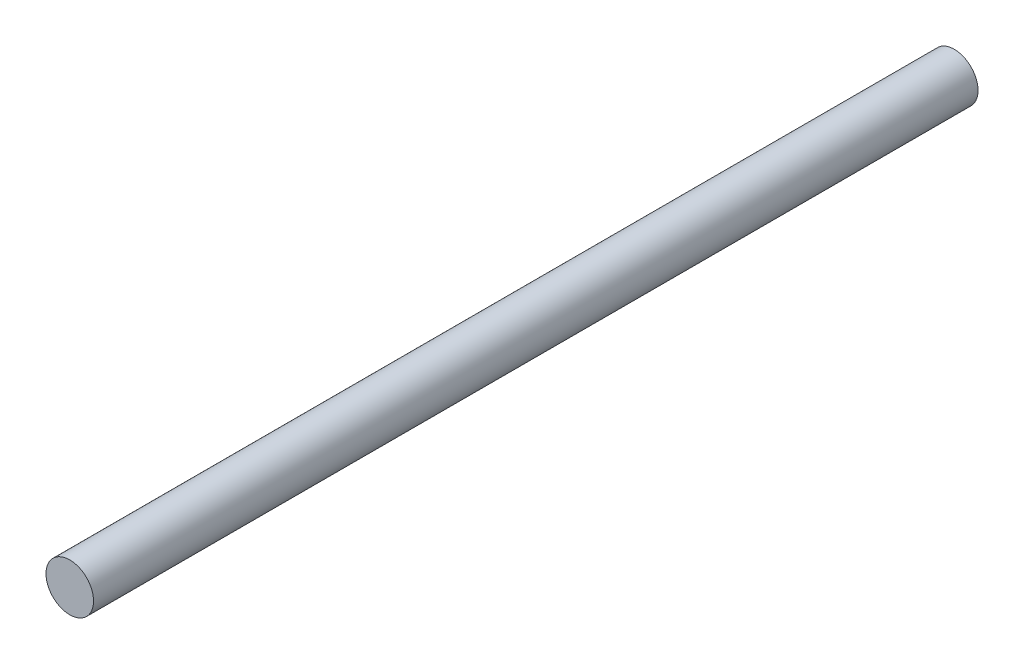
from build123d import *

# Parameters (mm, degrees)
SKETCH1_R           = 2.5
BOSS_EXTRUDE1_DEPTH = 93


with BuildPart() as part:
    # Sketch1 → Boss-Extrude1 (new body)
    with BuildSketch(Plane.XY):
        with Locations(Location((0, 0, 0), (0, 0, 180))):
            Circle(SKETCH1_R)
    extrude(amount=BOSS_EXTRUDE1_DEPTH)


solid = part.part
